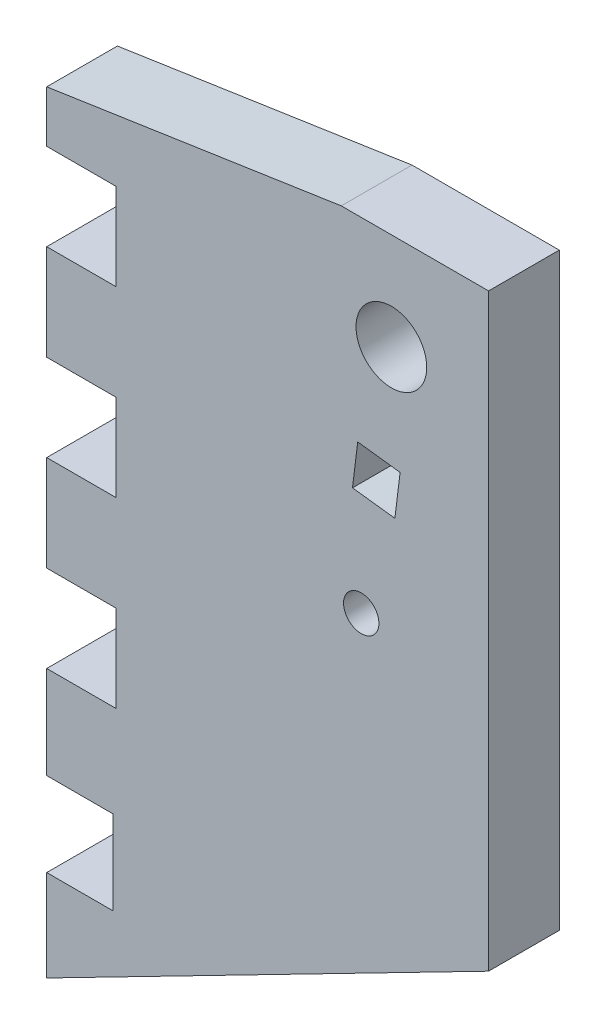
from build123d import *

# Parameters (mm, degrees)
SKETCH1_R           = 3.048
BOSS_EXTRUDE1_DEPTH = 6.096
CUT_EXTRUDE1_DEPTH  = 8.636
SKETCH4_W           = 5.715
SKETCH4_H           = 7.239
CUT_EXTRUDE2_DEPTH  = 81.243500547
SKETCH5_R           = 1.524
CUT_EXTRUDE4_DEPTH  = 6.096


with BuildPart() as part:
    # Sketch1 → Boss-Extrude1 (new body)
    with BuildSketch(Plane.XY):
        Polygon((0, 0), (-38.1, 0), (-38.1, -8.255), (-32.131, -8.255), (-32.131, -15.748), (-38.1, -15.748), (-38.1, -24.003), (-32.131, -24.003), (-32.131, -31.496), (-38.1, -31.496), (-38.1, -39.751), (-32.131, -39.751), (-32.131, -47.244), (-38.1, -47.244), (-38.1, -70.358), (0, -50.8), align=None)
        with Locations(Location((-8.382, -8.382, 0), (0, 0, 180))):
            Circle(SKETCH1_R, mode=Mode.SUBTRACT)
    extrude(amount=BOSS_EXTRUDE1_DEPTH)

    # Sketch2 → Cut-Extrude1 (cut)
    with BuildSketch(Plane(origin=(0, 0, 0), x_dir=(-1, 0, 0), z_dir=(0, 0, -1))):
        Polygon((38.1, 0), (12.7, 0), (38.1, -3.81), align=None)
    extrude(amount=-CUT_EXTRUDE1_DEPTH, mode=Mode.SUBTRACT)

    # Sketch4 → Cut-Extrude2 (cut, through all)
    with BuildSketch(Plane.XY.offset(6.096)):
        with Locations((-35.2425, -58.8645)):
            Rectangle(SKETCH4_W, SKETCH4_H)
    extrude(amount=-CUT_EXTRUDE2_DEPTH, mode=Mode.SUBTRACT)

    # Sketch5 → Cut-Extrude4 (cut)
    with BuildSketch(Plane(origin=(0, 0, 0), x_dir=(-1, 0, 0), z_dir=(0, 0, -1))):
        with Locations((10.982204311, -29.558964691)):
            Circle(SKETCH5_R)
        Polygon((7.629906021, -17.367131003), (11.285453498, -16.918286212), (11.73429829, -20.573833688), (8.078750813, -21.02267848), align=None)
    extrude(amount=-CUT_EXTRUDE4_DEPTH, mode=Mode.SUBTRACT)


solid = part.part
